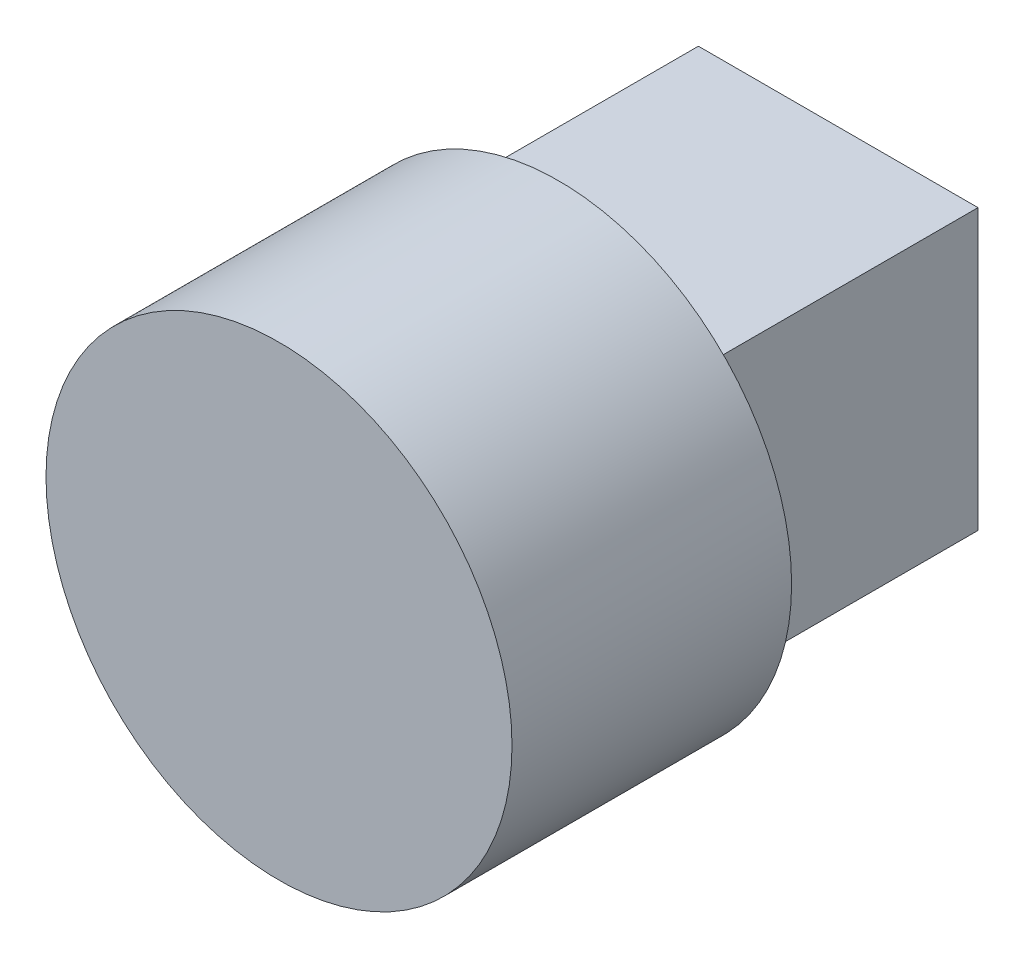
from build123d import *

# Parameters (mm, degrees)
BOSS_EXTRUDE1_DEPTH = 3
SKETCH2_R           = 2.5
BOSS_EXTRUDE2_DEPTH = 3


with BuildPart() as part:
    # Sketch1 → Boss-Extrude1 (new body)
    with BuildSketch(Plane.XY):
        Polygon((-1.5, 0), (-1.5, 1.5), (1.5, 1.5), (1.5, -1.5), (-1.5, -1.5), align=None)
    extrude(amount=BOSS_EXTRUDE1_DEPTH)

    # Sketch2 → Boss-Extrude2 (add)
    with BuildSketch(Plane.XY.offset(3)):
        Circle(SKETCH2_R)
    extrude(amount=BOSS_EXTRUDE2_DEPTH)


solid = part.part
